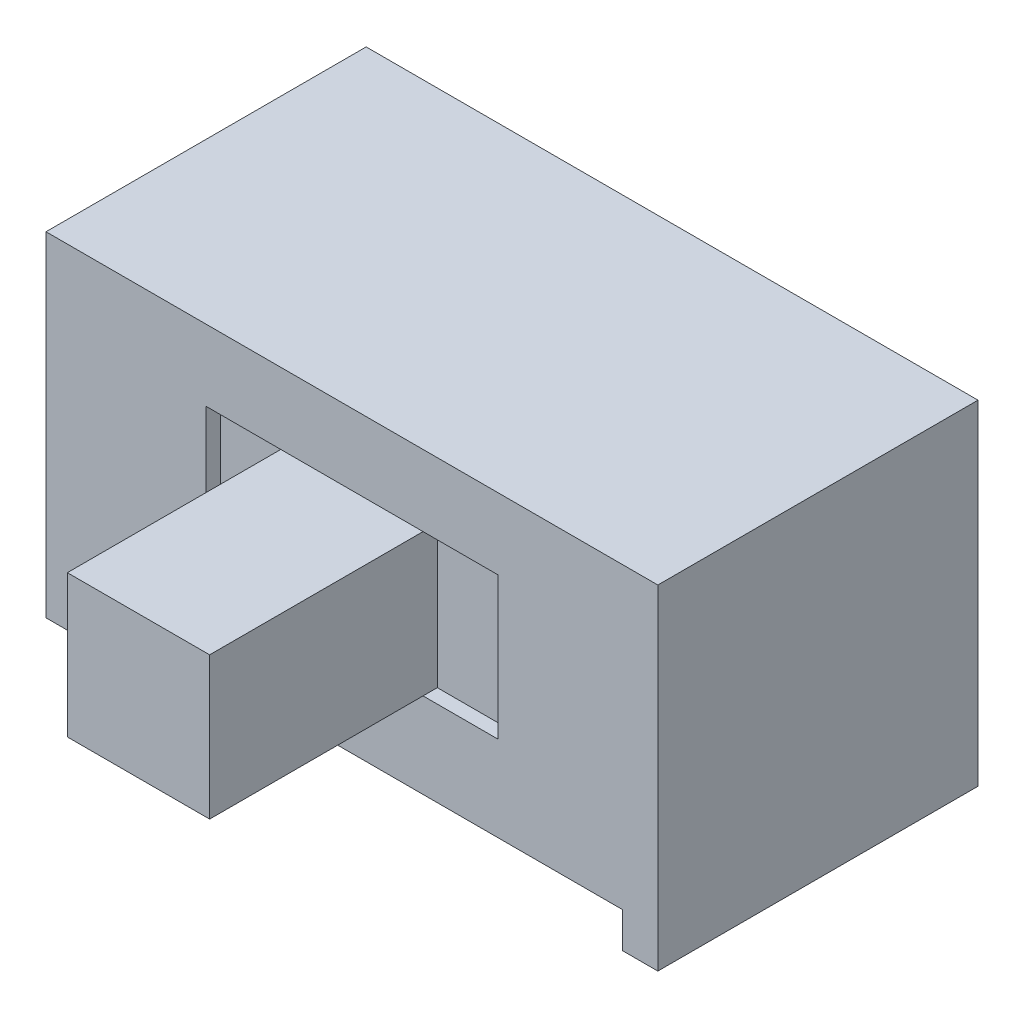
from build123d import *

# Parameters (mm, degrees)
SKETCH_1_W                  = 8.6
SKETCH_1_H                  = 4.5
EXTRUDE_1_DEPTH             = 4.7
SKETCH_2_W                  = 4.1
SKETCH_2_H                  = 2
CUT_EXTRUDE_1_DEPTH         = 0.2
CUT_EXTRUDE_2_REACH         = 12.784
SKETCH_4_W                  = 7.6
SKETCH_4_H                  = 0.5
SKETCH_5_W                  = 2
SKETCH_5_H                  = 2
EXTRUDE_2_DEPTH             = 3
EXTRUDE_2_DIRECTION_2_REACH = 12.784


with BuildPart() as part:
    # 草图1 → 凸台-拉伸1 (new body)
    with BuildSketch(Plane(origin=(0, 0, 0), x_dir=(1, 0, 0), z_dir=(0, 1, 0))):
        with Locations((4.3, 2.25)):
            Rectangle(SKETCH_1_W, SKETCH_1_H)
    extrude(amount=EXTRUDE_1_DEPTH)

    # 草图2 → 切除-拉伸1 (cut)
    with BuildSketch(Plane.XY):
        with Locations((4.3, 2.7)):
            Rectangle(SKETCH_2_W, SKETCH_2_H)
    extrude(amount=-CUT_EXTRUDE_1_DEPTH, mode=Mode.SUBTRACT)

    # 草图4 → 切除-拉伸2 (cut, up to next)
    with BuildSketch(Plane.XY, mode=Mode.PRIVATE) as cut_extrude_2_sk1:
        with Locations((4.3, 0.25)):
            Rectangle(SKETCH_4_W, SKETCH_4_H)
    cut_extrude_2_tool1 = extrude(cut_extrude_2_sk1.sketch, amount=-CUT_EXTRUDE_2_REACH, mode=Mode.PRIVATE) & part.part
    add(cut_extrude_2_tool1.solids().sort_by_distance((4.3, 0.25, 0))[0], mode=Mode.SUBTRACT)

    # 草图5 → 凸台-拉伸2 (add)
    with BuildSketch(Plane.XY):
        with Locations((4.3, 2.7)):
            Rectangle(SKETCH_5_W, SKETCH_5_H)
    extrude(amount=EXTRUDE_2_DEPTH)

    # 凸台-拉伸2 direction 2: up to this face of the body (flat: up to its plane)
    extrude_2_direction_2_end = Plane(part.part.faces().sort_by_distance((4.3, 2.7, -0.2))[0])
    # 草图5 → 凸台-拉伸2 direction 2 (add, up to the picked face)
    with BuildSketch(Plane.XY, mode=Mode.PRIVATE) as extrude_2_direction_2_sk1:
        with Locations((4.3, 2.7)):
            Rectangle(SKETCH_5_W, SKETCH_5_H)
    extrude_2_direction_2_tool1 = split(extrude(extrude_2_direction_2_sk1.sketch, amount=-EXTRUDE_2_DIRECTION_2_REACH, mode=Mode.PRIVATE), bisect_by=extrude_2_direction_2_end, keep=Keep.BOTH, mode=Mode.PRIVATE)
    add(extrude_2_direction_2_tool1.solids().sort_by(Axis((4.3, 2.7, 0), (0, 0, -1)))[0])


solid = part.part
